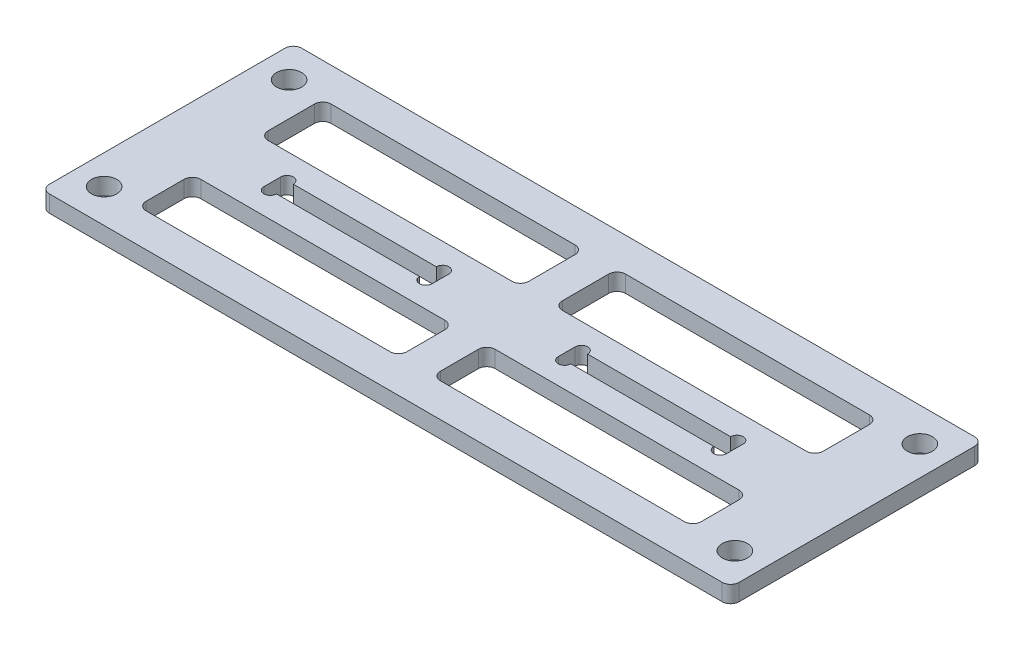
from build123d import *

# Parameters (mm, degrees)
SKETCH_1_W          = 82
SKETCH_1_H          = 30
SKETCH_1_R          = 1.5
SKETCH_1_W_2        = 20
SKETCH_1_H_2        = 2
EXTRUDE_1_DEPTH     = 2
SKETCH_4_R          = 0.75
CUT_EXTRUDE_1_DEPTH = 51.842895276
SKETCH_5_W          = 31
SKETCH_5_H          = 6.5
SKETCH_5_H_2        = 7.5
CUT_EXTRUDE_2_DEPTH = 51.842895276
FILLET_1_R          = 1


with BuildPart() as part:
    # 草图1 → 凸台-拉伸1 (new body)
    with BuildSketch(Plane(origin=(0, 0, 0), x_dir=(1, 0, 0), z_dir=(0, 1, 0))):
        with Locations((0, 15)):
            Rectangle(SKETCH_1_W, SKETCH_1_H)
        with Locations(Location((-37.5, 26, 0), (0, 0, 270))):
            Circle(SKETCH_1_R, mode=Mode.SUBTRACT)
        with Locations(Location((-37.5, 4, 0), (0, 0, 270))):
            Circle(SKETCH_1_R, mode=Mode.SUBTRACT)
        with Locations(Location((37.5, 26, 0), (0, 0, 270))):
            Circle(SKETCH_1_R, mode=Mode.SUBTRACT)
        with Locations(Location((37.5, 4, 0), (0, 0, 270))):
            Circle(SKETCH_1_R, mode=Mode.SUBTRACT)
        with Locations((17, 14.5)):
            Rectangle(SKETCH_1_W_2, SKETCH_1_H_2, mode=Mode.SUBTRACT)
        with Locations((-18, 14.5)):
            Rectangle(SKETCH_1_W_2, SKETCH_1_H_2, mode=Mode.SUBTRACT)
    extrude(amount=EXTRUDE_1_DEPTH)

    # 草图4 → 切除-拉伸1 (cut, through all)
    with BuildSketch(Plane(origin=(0, 2, 0), x_dir=(1, 0, 0), z_dir=(0, 1, 0))):
        with Locations((-27.25, 15.5)):
            Circle(SKETCH_4_R)
        with Locations((-27.25, 13.5)):
            Circle(SKETCH_4_R)
        with Locations((-8.75, 15.5)):
            Circle(SKETCH_4_R)
        with Locations((-8.75, 13.5)):
            Circle(SKETCH_4_R)
        with Locations((7.75, 15.5)):
            Circle(SKETCH_4_R)
        with Locations((7.75, 13.5)):
            Circle(SKETCH_4_R)
        with Locations((26.25, 15.5)):
            Circle(SKETCH_4_R)
        with Locations((26.25, 13.5)):
            Circle(SKETCH_4_R)
    extrude(amount=-CUT_EXTRUDE_1_DEPTH, mode=Mode.SUBTRACT)

    # 草图5 → 切除-拉伸2 (cut, through all)
    with BuildSketch(Plane(origin=(0, 2, 0), x_dir=(1, 0, 0), z_dir=(0, 1, 0))):
        with Locations((-18, 7.25)):
            Rectangle(SKETCH_5_W, SKETCH_5_H)
        with Locations((-18, 22.25)):
            Rectangle(SKETCH_5_W, SKETCH_5_H_2)
        with Locations((17, 22.25)):
            Rectangle(SKETCH_5_W, SKETCH_5_H_2)
        with Locations((17, 7.25)):
            Rectangle(SKETCH_5_W, SKETCH_5_H)
    extrude(amount=-CUT_EXTRUDE_2_DEPTH, mode=Mode.SUBTRACT)

    # 圆角1
    fillet_1_edges = [part.edges().sort_by_distance(p)[0] for p in [
        (1.5, 1, -10.5),
        (32.5, 1, -10.5),
        (32.5, 1, -4),
        (1.5, 1, -4),
        (1.5, 1, -26),
        (32.5, 1, -26),
        (32.5, 1, -18.5),
        (1.5, 1, -18.5),
        (-33.5, 1, -18.5),
        (-33.5, 1, -26),
        (-2.5, 1, -26),
        (-2.5, 1, -18.5),
        (-33.5, 1, -4),
        (-33.5, 1, -10.5),
        (-2.5, 1, -10.5),
        (-2.5, 1, -4),
        (-41, 1, -30),
        (41, 1, -30),
        (41, 1, 0),
        (-41, 1, 0),
    ]]
    fillet(fillet_1_edges, radius=FILLET_1_R)


solid = part.part
